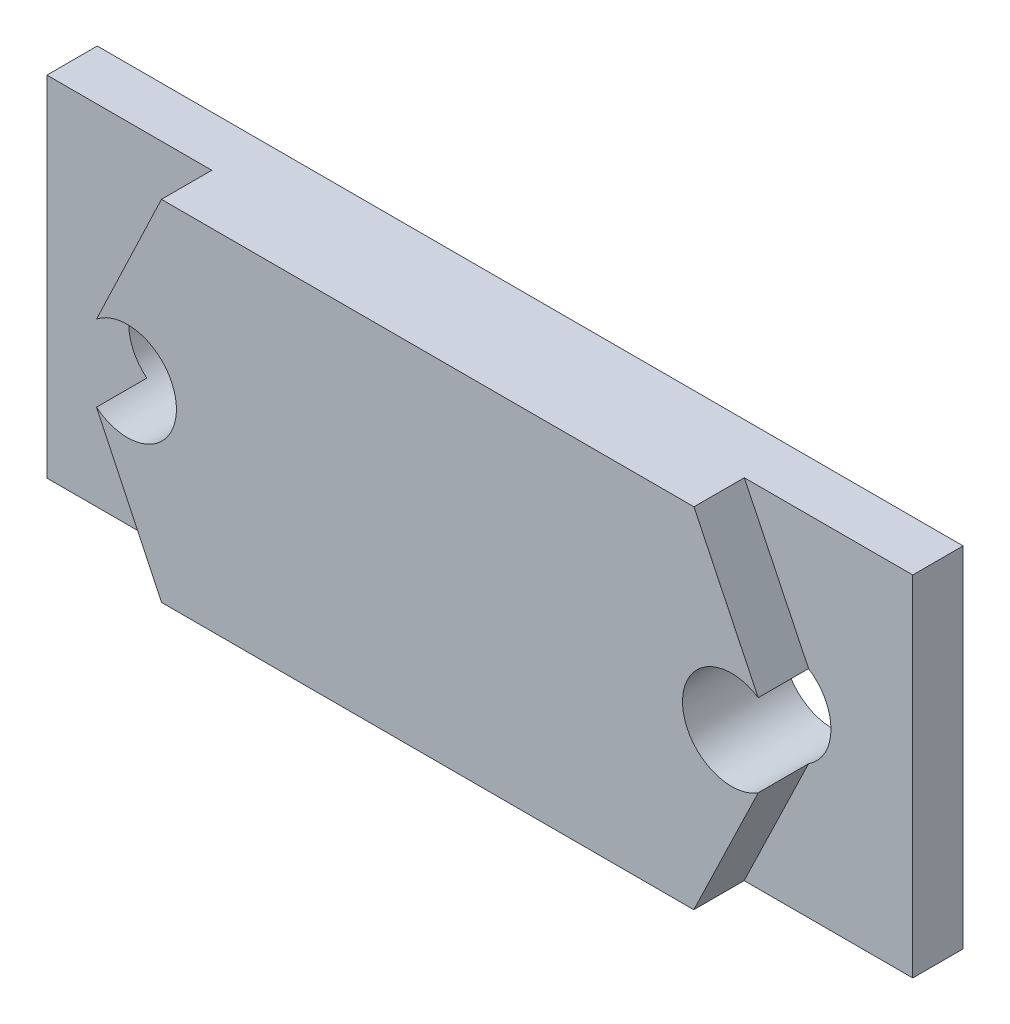
from build123d import *

# Parameters (mm, degrees)
SKETCH3_W           = 34.39206684
SKETCH3_H           = 13.864626052
SKETCH3_R           = 1.948262706
BOSS_EXTRUDE1_DEPTH = 4
CUT_EXTRUDE2_DEPTH  = 2


with BuildPart() as part:
    # Sketch3 → Boss-Extrude1 (new body)
    with BuildSketch(Plane(origin=(0, 0, 0), x_dir=(-1, 0, 0), z_dir=(0, 0, 1))):
        with Locations((-14.628449162, 10.554141489)):
            Rectangle(SKETCH3_W, SKETCH3_H)
        with Locations(Location((-26.628449162, 10.547774914, 0), (0, 0, 180))):
            Circle(SKETCH3_R, mode=Mode.SUBTRACT)
        with Locations(Location((-2.628449162, 10.547774914, 0), (0, 0, 180))):
            Circle(SKETCH3_R, mode=Mode.SUBTRACT)
    extrude(amount=BOSS_EXTRUDE1_DEPTH)

    # Sketch4 → Cut-Extrude2 (cut)
    with BuildSketch(Plane.XY.offset(4)):
        Polygon((3.987302292, -3.609095314), (-2.567584258, -3.609095314), (-2.567584258, -17.486454515), (3.987302292, -17.486454515), (0.680186456, -10.547774914), align=None)
        Polygon((25.128096542, -3.609095314), (31.824482582, -3.609095314), (31.824482582, -17.486454515), (25.128096542, -17.486454515), (28.476289562, -10.547774914), align=None)
    extrude(amount=-CUT_EXTRUDE2_DEPTH, mode=Mode.SUBTRACT)


solid = part.part
